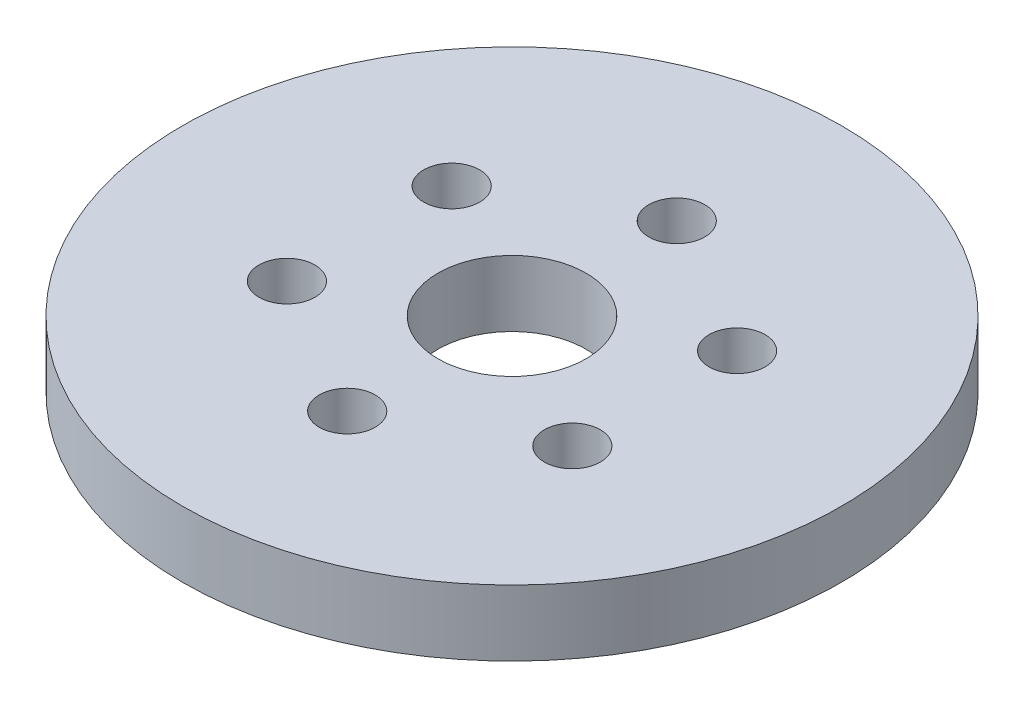
from build123d import *

# Parameters (mm, degrees)
SKETCH_1_R          = 20
SKETCH_1_R_2        = 4.5
EXTRUDE_1_DEPTH     = 4
SKETCH_2_R          = 1.7
CUT_EXTRUDE_1_DEPTH = 29.565713714


with BuildPart() as part:
    # 草图1 → 凸台-拉伸1 (new body)
    with BuildSketch(Plane(origin=(0, 0, 0), x_dir=(1, 0, 0), z_dir=(0, 1, 0))):
        with Locations(Location((0, 0, 0), (0, 0, 270))):
            Circle(SKETCH_1_R)
        with Locations(Location((0, 0, 0), (0, 0, 270))):
            Circle(SKETCH_1_R_2, mode=Mode.SUBTRACT)
    extrude(amount=EXTRUDE_1_DEPTH)

    # 草图2 → 切除-拉伸1 (cut, through all)
    with BuildSketch(Plane(origin=(0, 4, 0), x_dir=(1, 0, 0), z_dir=(0, 1, 0))):
        with Locations(Location((0, 10, 0), (0, 0, 270))):
            Circle(SKETCH_2_R)
        with Locations(Location((8.660254038, 5, 0), (0, 0, 270))):
            Circle(SKETCH_2_R)
        with Locations(Location((8.660254038, -5, 0), (0, 0, 270))):
            Circle(SKETCH_2_R)
        with Locations(Location((0, -10, 0), (0, 0, 270))):
            Circle(SKETCH_2_R)
        with Locations(Location((-8.660254038, -5, 0), (0, 0, 270))):
            Circle(SKETCH_2_R)
        with Locations(Location((-8.660254038, 5, 0), (0, 0, 270))):
            Circle(SKETCH_2_R)
    extrude(amount=-CUT_EXTRUDE_1_DEPTH, mode=Mode.SUBTRACT)


solid = part.part
